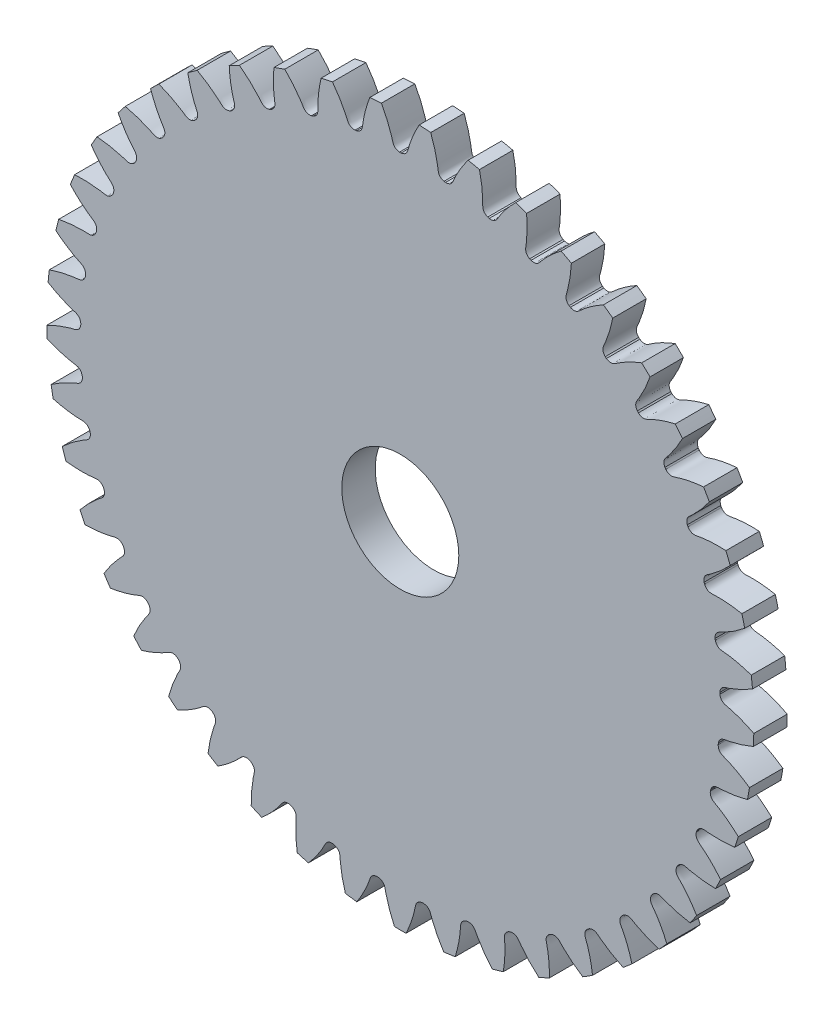
from build123d import *

# Parameters (mm, degrees)
SKETCH_1_R               = 10.575
EXTRUDE_1_DEPTH          = 1
CUT_EXTRUDE_1_DEPTH      = 15.98870408
PATTERN_CIRCULAR_1_COUNT = 45
SKETCH_4_R               = 1.75
CUT_EXTRUDE_2_DEPTH      = 15.987419743


with BuildPart() as part:
    # 草图1 → 凸台-拉伸1 (new body)
    with BuildSketch(Plane.XY):
        Circle(SKETCH_1_R)
    extrude(amount=EXTRUDE_1_DEPTH)

    # 草图2 → 切除-拉伸1 (cut, through all)
    with BuildSketch(Plane.XY):
        with BuildLine():
            ThreePointArc((0.023342969, 9.562471509), (0, 9.5625), (-0.023342969, 9.562471509))
            add(Edge.make_bspline(
                [(-0.023342969, 9.562471509), (-0.199607461, 9.586844803), (-0.219626048, 9.717635684), (-0.261281558, 9.859317988), (-0.277284473, 9.910665665), (-0.295569165, 9.965264052), (-0.316205369, 10.023079098), (-0.33934814, 10.084025868), (-0.365124689, 10.14802913), (-0.393667642, 10.215005532), (-0.425105138, 10.28486891), (-0.459563583, 10.357528808), (-0.497166714, 10.432890989), (-0.538035727, 10.510857368), (-0.582289116, 10.591326115), (-0.630042583, 10.674191716), (-0.681408937, 10.759345045), (-0.736497994, 10.846673436), (-0.795416486, 10.936060765), (-0.858267962, 11.027387522), (-0.925152697, 11.1205309), (-0.996167604, 11.21536487), (-1.071406141, 11.311760275), (-1.150958233, 11.409584913), (-1.234910175, 11.508703628), (-1.323344571, 11.608978406), (-1.416340208, 11.710268464), (-1.548269118, 11.848318659), (-1.651688099, 11.950153131), (-1.722848965, 12.017545794)],
                knots=[0, 0, 0, 0, 0.112268392, 0.128789174, 0.146568276, 0.165605699, 0.185901442, 0.207455506, 0.23026789, 0.254338595, 0.27966762, 0.306254966, 0.334100632, 0.363204619, 0.393566926, 0.425187554, 0.458066503, 0.492203772, 0.527599361, 0.564253271, 0.602165502, 0.641336053, 0.681764924, 0.723452116, 0.766397629, 0.810601462, 0.856063616, 0.90278409, 1, 1, 1, 1], degree=3))
            ThreePointArc((-1.722848965, 12.017545794), (0, 12.140412492), (1.722848965, 12.017545794))
            add(Edge.make_bspline(
                [(0.023342969, 9.562471509), (0.199607461, 9.586844803), (0.219626048, 9.717635684), (0.261281558, 9.859317988), (0.277284473, 9.910665665), (0.295569165, 9.965264052), (0.316205369, 10.023079098), (0.33934814, 10.084025868), (0.365124689, 10.14802913), (0.393667642, 10.215005532), (0.425105138, 10.28486891), (0.459563583, 10.357528808), (0.497166714, 10.432890989), (0.538035727, 10.510857368), (0.582289116, 10.591326115), (0.630042583, 10.674191716), (0.681408937, 10.759345045), (0.736497994, 10.846673436), (0.795416486, 10.936060765), (0.858267962, 11.027387522), (0.925152697, 11.1205309), (0.996167604, 11.21536487), (1.071406141, 11.311760275), (1.150958233, 11.409584913), (1.234910175, 11.508703628), (1.323344571, 11.608978406), (1.416340208, 11.710268464), (1.548269118, 11.848318659), (1.651688099, 11.950153131), (1.722848965, 12.017545794)],
                knots=[0, 0, 0, 0, 0.112268392, 0.128789174, 0.146568276, 0.165605699, 0.185901442, 0.207455506, 0.23026789, 0.254338595, 0.27966762, 0.306254966, 0.334100632, 0.363204619, 0.393566926, 0.425187554, 0.458066503, 0.492203772, 0.527599361, 0.564253271, 0.602165502, 0.641336053, 0.681764924, 0.723452116, 0.766397629, 0.810601462, 0.856063616, 0.90278409, 1, 1, 1, 1], degree=3))
        make_face()
    cut_extrude_1 = extrude(amount=CUT_EXTRUDE_1_DEPTH, mode=Mode.SUBTRACT)

    # 阵列(圆周)1: 切除-拉伸1 ×45 about axis
    pattern_circular_1_axis = Axis((0, 0, 1), (0, 0, -1))
    for i in range(1, PATTERN_CIRCULAR_1_COUNT):
        add(cut_extrude_1.rotate(pattern_circular_1_axis, i * 360 / PATTERN_CIRCULAR_1_COUNT), mode=Mode.SUBTRACT)

    # 草图4 → 切除-拉伸2 (cut, through all)
    with BuildSketch(Plane.XY.offset(1)):
        Circle(SKETCH_4_R)
    extrude(amount=-CUT_EXTRUDE_2_DEPTH, mode=Mode.SUBTRACT)


solid = part.part
